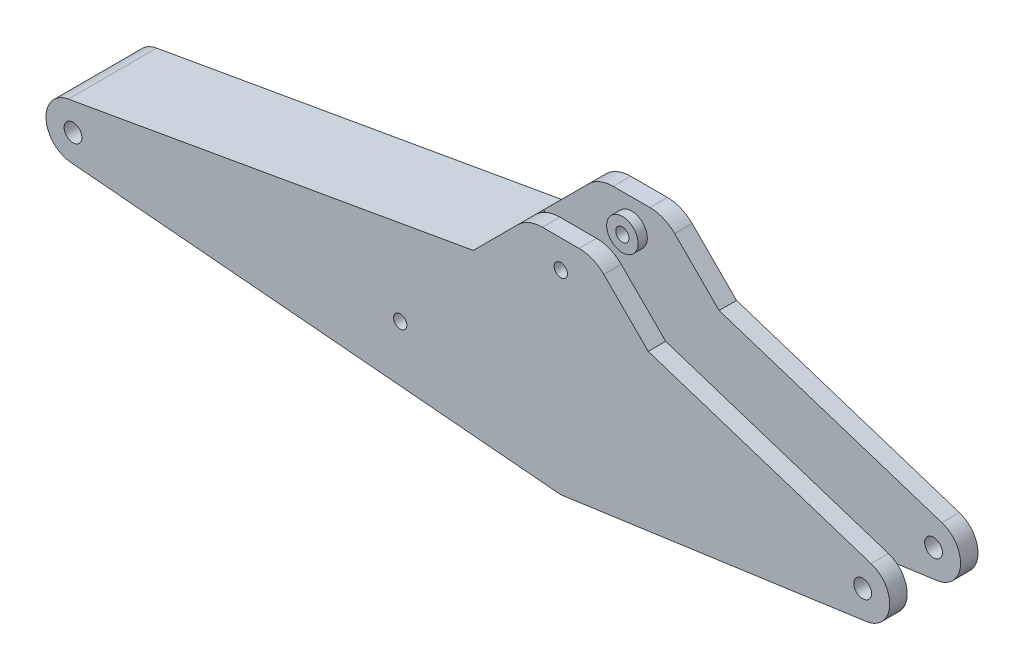
from build123d import *

# Parameters (mm, degrees)
SKETCH1_R           = 38
SKETCH1_R_2         = 51
BOSS_EXTRUDE2_DEPTH = 100
BOSS_EXTRUDE4_START = 306
BOSS_EXTRUDE4_DEPTH = 306
BOSS_EXTRUDE5_START = 53
SKETCH7_R           = 90
SKETCH7_R_2         = 38
BOSS_EXTRUDE5_DEPTH = 53


with BuildPart() as part:
    # Sketch1 → Boss-Extrude2 (new body)
    # profile 1 of 2: a face of its own
    with BuildSketch(Plane.XY):
        with BuildLine():
            Line((4546.601139584, -153.487428699), (2795, -400))
            Line((2795, -400), (-13.502435017, -154.410764679))
            ThreePointArc((-13.502435017, -154.410764679), (-154.85218061, -6.767729338), (-26.922095967, 152.644032798))
            Line((-26.922095967, 152.644032798), (2293.701564181, 561.936500623))
            Line((2293.701564181, 561.936500623), (3296.298435819, 561.936500623))
            Line((3296.298435819, 561.936500623), (4572.869484486, 147.422903428))
            ThreePointArc((4572.869484486, 147.422903428), (4679.41275497, -13.479655139), (4546.601139584, -153.487428699))
        make_face()
        with Locations((1875, 0)):
            Circle(SKETCH1_R, mode=Mode.SUBTRACT)
        with Locations((4525, 0)):
            Circle(SKETCH1_R_2, mode=Mode.SUBTRACT)
        Circle(SKETCH1_R_2, mode=Mode.SUBTRACT)
    # profile 2 of 2: a face of its own
    with BuildSketch(Plane.XY):
        with BuildLine():
            ThreePointArc((2900.392223967, 875), (2976.92891044, 859.775906502), (3041.813580205, 816.421356237))
            Line((3041.813580205, 816.421356237), (3296.298435819, 561.936500623))
            Line((3296.298435819, 561.936500623), (2293.701564181, 561.936500623))
            Line((2293.701564181, 561.936500623), (2548.186419795, 816.421356237))
            ThreePointArc((2548.186419795, 816.421356237), (2613.07108956, 859.775906502), (2689.607776033, 875))
            Line((2689.607776033, 875), (2900.392223967, 875))
        make_face()
        with Locations((2795, 714.936500623)):
            Circle(SKETCH1_R, mode=Mode.SUBTRACT)
    boss_extrude2 = extrude(amount=-BOSS_EXTRUDE2_DEPTH)

    # Sketch4 → Boss-Extrude4 (add)
    with BuildSketch(Plane.XY.offset(BOSS_EXTRUDE4_START)):
        with BuildLine():
            Line((2795, -400), (-13.502435017, -154.410764679))
            ThreePointArc((-13.502435017, -154.410764679), (-154.85218061, -6.767729338), (-26.922095967, 152.644032798))
            Line((-26.922095967, 152.644032798), (2293.701564181, 561.936500623))
            Line((2293.701564181, 561.936500623), (2300.64920185, 522.544492159))
            Line((2300.64920185, 522.544492159), (-19.974458298, 113.252024334))
            ThreePointArc((-19.974458298, 113.252024334), (-114.890327549, -5.021218541), (-10.017935657, -114.562825407))
            Line((-10.017935657, -114.562825407), (2793.941422657, -359.754791807))
            Line((2793.941422657, -359.754791807), (3813.425512366, -216.277125188))
            Line((3813.425512366, -216.277125188), (3819, -255.886784207))
            Line((3819, -255.886784207), (2795, -400))
        make_face()
    extrude(amount=-BOSS_EXTRUDE4_DEPTH)

    # Sketch7 → Boss-Extrude5 (add)
    # profile 1 of 2: a face of its own
    with BuildSketch(Plane.XY.offset(BOSS_EXTRUDE5_START)):
        with Locations((2795, 714.936500623)):
            Circle(SKETCH7_R)
        with Locations((2795, 714.936500623)):
            Circle(SKETCH7_R_2, mode=Mode.SUBTRACT)
    # profile 2 of 2: a face of its own
    with BuildSketch(Plane.XY.offset(BOSS_EXTRUDE5_START)):
        with Locations((1875, 0)):
            Circle(SKETCH7_R)
        with Locations((1875, 0)):
            Circle(SKETCH7_R_2, mode=Mode.SUBTRACT)
    boss_extrude5 = extrude(amount=-BOSS_EXTRUDE5_DEPTH)

    # Mirror2: Boss-Extrude2, Boss-Extrude5 across plane
    add(boss_extrude2.mirror(Plane.XY.offset(153)))
    add(boss_extrude5.mirror(Plane.XY.offset(153)))


solid = part.part
